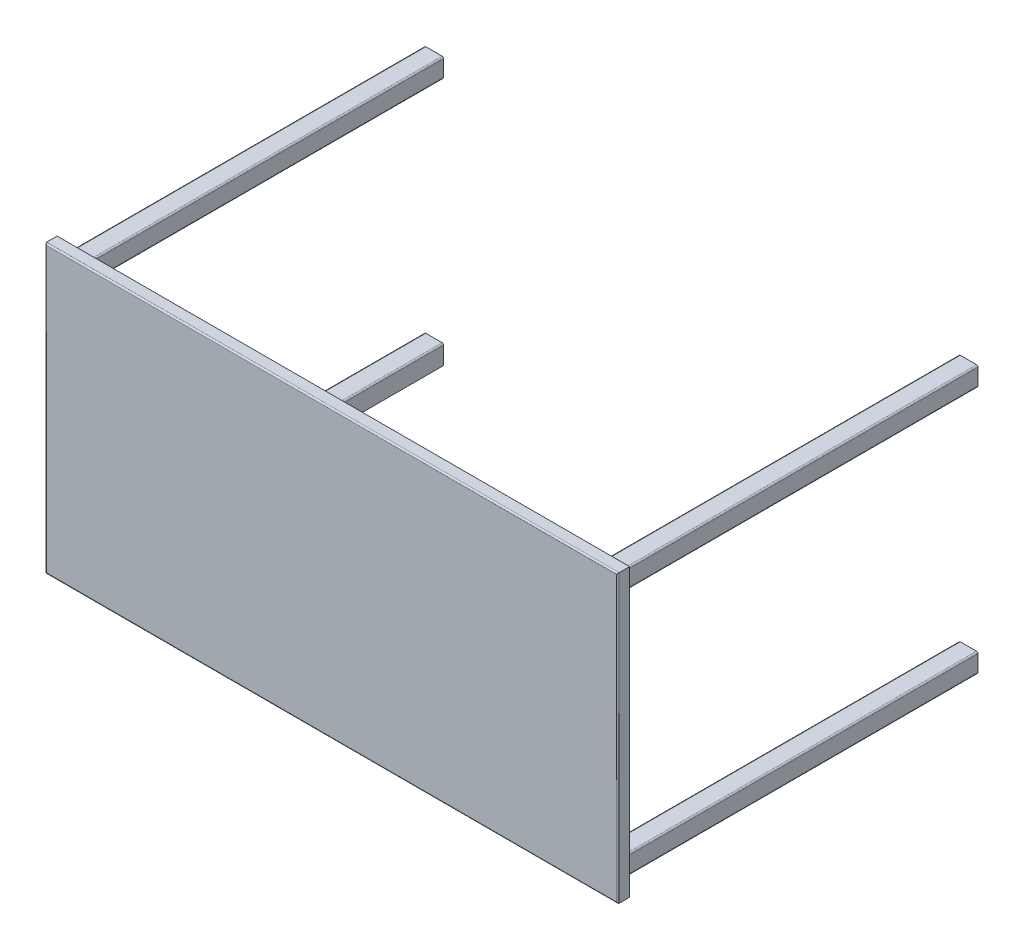
from build123d import *

# Parameters (mm, degrees)
SKETCH1_W           = 1200
SKETCH1_H           = 600
BOSS_EXTRUDE1_DEPTH = 25
SKETCH2_W           = 40
SKETCH2_H           = 40
BOSS_EXTRUDE2_DEPTH = 750
FILLET1_R           = 3


with BuildPart() as part:
    # Sketch1 → Boss-Extrude1 (new body)
    with BuildSketch(Plane.XY):
        Rectangle(SKETCH1_W, SKETCH1_H)
    extrude(amount=BOSS_EXTRUDE1_DEPTH)

    # Sketch2 → Boss-Extrude2 (add)
    with BuildSketch(Plane.XY):
        with Locations((-560, 260)):
            Rectangle(SKETCH2_W, SKETCH2_H)
        with Locations((560, 260)):
            Rectangle(SKETCH2_W, SKETCH2_H)
        with Locations((-560, -260)):
            Rectangle(SKETCH2_W, SKETCH2_H)
        with Locations((560, -260)):
            Rectangle(SKETCH2_W, SKETCH2_H)
    extrude(amount=-BOSS_EXTRUDE2_DEPTH)

    # Fillet1
    fillet1_edges = [part.edges().sort_by_distance(p)[0] for p in [
        (-600, 0, 25),
        (0, -300, 25),
        (580, 280, -375),
        (580, 240, -375),
        (540, 280, -375),
        (-540, -240, -375),
        (-580, -280, -375),
        (-580, -240, -375),
        (580, -240, -375),
        (580, -280, -375),
        (540, -240, -375),
        (-540, 280, -375),
        (-540, 240, -375),
        (-580, 280, -375),
        (600, 0, 25),
        (0, 300, 25),
    ]]
    fillet(fillet1_edges, radius=FILLET1_R)


solid = part.part
